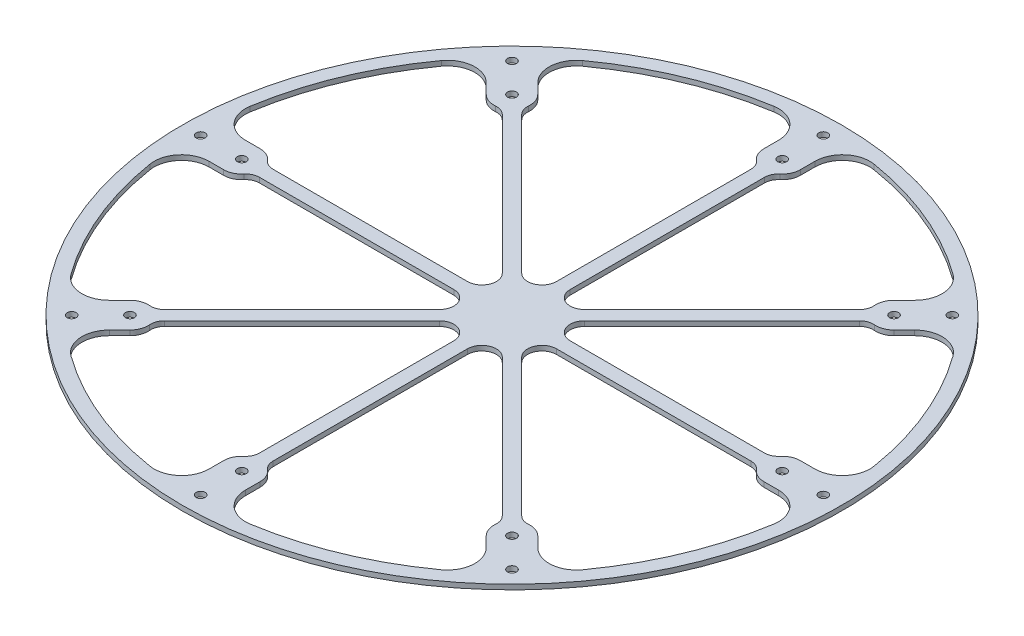
from build123d import *

# Parameters (mm, degrees)
SKETCH1_R           = 152.4
SKETCH1_R_2         = 2.070099999999984
SKETCH1_R_3         = 2.0700999999999827
SKETCH1_R_4         = 2.070099999999987
SKETCH1_R_5         = 2.0700999999999805
SKETCH1_R_6         = 2.070099999999982
SKETCH1_R_7         = 2.070099999999981
SKETCH1_R_8         = 2.07009999999998
SKETCH1_R_9         = 2.0700999999999787
SKETCH1_R_10        = 2.070099999999999
SKETCH1_R_11        = 2.070099999999978
SKETCH1_R_12        = 2.0700999999999765
SKETCH1_R_13        = 2.0700999999999934
SKETCH1_R_14        = 2.0700999999999747
BOSS_EXTRUDE1_DEPTH = 2.286
CUT_EXTRUDE1_DEPTH  = 216.53826991047322
CIRPATTERN1_COUNT   = 8
FILLET1_R           = 6.35


with BuildPart() as part:
    # Sketch1 → Boss-Extrude1 (new body)
    with BuildSketch(Plane(origin=(0, 0, 0), x_dir=(1, 0, 0), z_dir=(0, 1, 0))):
        with Locations(Location((0, 0, 0), (0, 0, 270))):
            Circle(SKETCH1_R)
        with Locations(Location((-143.9799, 1.749e-14, 0), (0, 0, 270))):
            Circle(SKETCH1_R_2, mode=Mode.SUBTRACT)
        with Locations(Location((-124.9299, -1.53e-14, 0), (0, 0, 270))):
            Circle(SKETCH1_R_3, mode=Mode.SUBTRACT)
        with Locations(Location((-101.8091636445608, 101.80916364456118, 0), (0, 0, 270))):
            Circle(SKETCH1_R_4, mode=Mode.SUBTRACT)
        with Locations(Location((-88.33877946295712, 88.33877946295739, 0), (0, 0, 270))):
            Circle(SKETCH1_R_5, mode=Mode.SUBTRACT)
        with Locations(Location((5.202e-13, 143.9799, 0), (0, 0, 270))):
            Circle(SKETCH1_R_6, mode=Mode.SUBTRACT)
        with Locations(Location((4.2089e-13, 124.9299, 0), (0, 0, 270))):
            Circle(SKETCH1_R_7, mode=Mode.SUBTRACT)
        with Locations(Location((101.80916364456154, 101.80916364456044, 0), (0, 0, 270))):
            Circle(SKETCH1_R_4, mode=Mode.SUBTRACT)
        with Locations(Location((88.3387794629577, 88.33877946295681, 0), (0, 0, 270))):
            Circle(SKETCH1_R_5, mode=Mode.SUBTRACT)
        with Locations(Location((143.9799, -1.0229e-12, 0), (0, 0, 270))):
            Circle(SKETCH1_R_8, mode=Mode.SUBTRACT)
        with Locations(Location((124.9299, -8.5708e-13, 0), (0, 0, 270))):
            Circle(SKETCH1_R_9, mode=Mode.SUBTRACT)
        with Locations(Location((101.8091636445601, -101.80916364456186, 0), (0, 0, 270))):
            Circle(SKETCH1_R_10, mode=Mode.SUBTRACT)
        with Locations(Location((88.33877946295651, -88.33877946295799, 0), (0, 0, 270))):
            Circle(SKETCH1_R_4, mode=Mode.SUBTRACT)
        with Locations(Location((-1.5256e-12, -143.9799, 0), (0, 0, 270))):
            Circle(SKETCH1_R_11, mode=Mode.SUBTRACT)
        with Locations(Location((-1.29327e-12, -124.9299, 0), (0, 0, 270))):
            Circle(SKETCH1_R_12, mode=Mode.SUBTRACT)
        with Locations(Location((-101.80916364456223, -101.80916364455973, 0), (0, 0, 270))):
            Circle(SKETCH1_R_13, mode=Mode.SUBTRACT)
        with Locations(Location((-88.3387794629583, -88.3387794629562, 0), (0, 0, 270))):
            Circle(SKETCH1_R_14, mode=Mode.SUBTRACT)
    extrude(amount=BOSS_EXTRUDE1_DEPTH)

    # Sketch2 → Cut-Extrude1 (cut, through all)
    with BuildSketch(Plane(origin=(0, 2.286, 0), x_dir=(1, 0, 0), z_dir=(0, 1, 0))):
        with BuildLine():
            ThreePointArc((3.1750000000002516, -117.13134506911759), (6.986841257319973, -120.23073696228855), (8.420099999998719, -124.9299))
            Line((8.420099999998717, -124.9299), (8.420099999998637, -131.6668670394721))
            ThreePointArc((8.420099999998639, -131.6668670394721), (12.88163120444934, -141.3321467511392), (23.131538095236692, -144.2065686622791))
            ThreePointArc((23.13153809523673, -144.2065686622791), (55.89091529692152, -134.93260572327338), (85.61297514632435, -118.32591003915775))
            ThreePointArc((85.6129751463244, -118.32591003915772), (90.82823058997255, -109.04560814479298), (87.14862473293043, -99.05644434946592))
            Line((87.14862473293043, -99.05644434946592), (82.38486965468944, -94.29268927122504))
            ThreePointArc((82.38486965468765, -94.29268927122683), (80.07552658096357, -89.95641224521594), (80.5793043576061, -85.06943241814194))
            Line((80.57930435760602, -85.069432418142), (14.554814795987514, -19.044942856522383))
            ThreePointArc((14.554814795987514, -19.04494285652238), (11.14164107789032, -17.22056340123132), (7.290119914433424, -17.599904875685596))
            ThreePointArc((7.290119914433424, -17.599904875685596), (4.298447514577617, -20.055106641508246), (3.174999999999997, -23.758616482314267))
            Line((3.174999999999999, -23.758616482314267), (3.175, -117.13134506911767))
        make_face()
    cut_extrude1 = extrude(amount=-CUT_EXTRUDE1_DEPTH, mode=Mode.SUBTRACT)

    # CirPattern1: Cut-Extrude1 ×8 about axis
    cirpattern1_axis = Axis((4.806e-14, 0, -1.941e-14), (0, 1, 0))
    for i in range(1, CIRPATTERN1_COUNT):
        add(cut_extrude1.rotate(cirpattern1_axis, i * 360 / CIRPATTERN1_COUNT), mode=Mode.SUBTRACT)

    # Fillet1
    fillet1_edges = [part.edges().sort_by_distance(p)[0] for p in [
        (117.1313450691169, 1.143, 3.1750000000009777),
        (85.06943241814194, 1.143, 80.57930435760721),
        (-85.06943241814196, 1.143, 80.57930435760598),
        (-117.1313450691176, 1.143, 3.1750000000000322),
        (-3.17500000000097, 1.143, 117.13134506911682),
        (-80.5793043576072, 1.143, 85.06943241814186),
        (-117.13134506911682, 1.143, -3.1750000000010234),
        (-85.06943241814184, 1.143, -80.57930435760727),
        (85.06943241814206, 1.143, -80.57930435760602),
        (117.1313450691177, 1.143, -3.175000000000084),
        (3.175000000001045, 1.143, -117.13134506911688),
        (80.57930435760728, 1.143, -85.06943241814191),
        (-80.57930435760595, 1.143, -85.06943241814203),
        (-3.175000000000016, 1.143, -117.13134506911767),
        (80.57930435760606, 1.143, 85.06943241814197),
        (3.175000000000126, 1.143, 117.13134506911763),
    ]]
    fillet(fillet1_edges, radius=FILLET1_R)


solid = part.part
